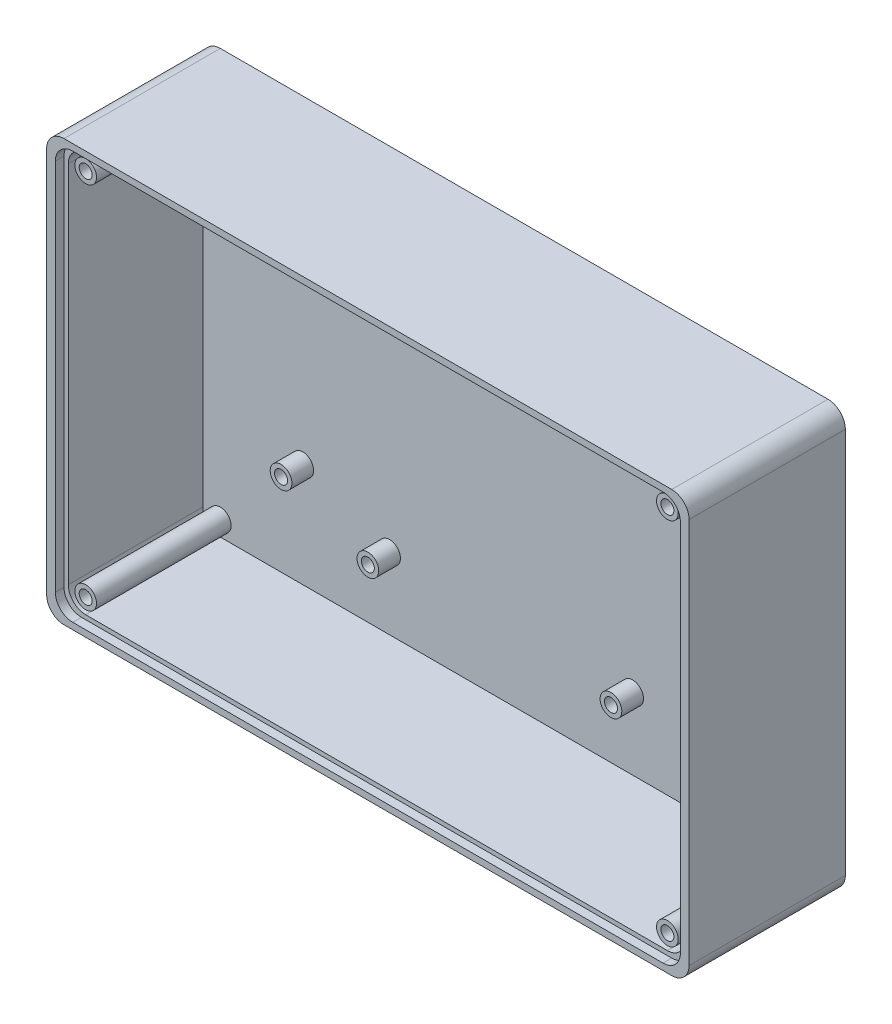
from build123d import *

# Parameters (mm, degrees)
RESSALTO_EXTRUS_O1_DEPTH = 18
CORTE_EXTRUS_O1_DEPTH    = 2
CORTE_EXTRUS_O2_DEPTH    = 31
ESBO_O4_R                = 2.5
ESBO_O4_R_2              = 1.5
RESSALTO_EXTRUS_O2_DEPTH = 5
ESBO_O5_R                = 2.5
ESBO_O5_R_2              = 1.5
RESSALTO_EXTRUS_O3_DEPTH = 31


with BuildPart() as part:
    # Esboço1 → Ressalto-extrusão1 (new, symmetric)
    with BuildSketch(Plane.XY):
        with BuildLine():
            Line((-70, -48.5), (70, -48.5))
            ThreePointArc((70, -48.5), (72.828427125, -47.328427125), (74, -44.5))
            Line((74, -44.5), (74, 44.5))
            ThreePointArc((74, 44.5), (72.828427125, 47.328427125), (70, 48.5))
            Line((70, 48.5), (-70, 48.5))
            ThreePointArc((-70, 48.5), (-72.828427125, 47.328427125), (-74, 44.5))
            Line((-74, 44.5), (-74, -44.5))
            ThreePointArc((-74, -44.5), (-72.828427125, -47.328427125), (-70, -48.5))
        make_face()
    extrude(amount=RESSALTO_EXTRUS_O1_DEPTH, both=True)

    # Esboço2 → Corte-extrusão1 (cut)
    with BuildSketch(Plane.XY.offset(18)):
        with BuildLine():
            Line((-68, -47), (68, -47))
            ThreePointArc((68, -47), (70.828427125, -45.828427125), (72, -43))
            Line((72, -43), (72, 43))
            ThreePointArc((72, 43), (70.828427125, 45.828427125), (68, 47))
            Line((68, 47), (-68, 47))
            ThreePointArc((-68, 47), (-70.828427125, 45.828427125), (-72, 43))
            Line((-72, 43), (-72, -43))
            ThreePointArc((-72, -43), (-70.828427125, -45.828427125), (-68, -47))
        make_face()
    extrude(amount=-CORTE_EXTRUS_O1_DEPTH, mode=Mode.SUBTRACT)

    # Esboço3 → Corte-extrusão2 (cut)
    with BuildSketch(Plane.XY.offset(16)):
        with BuildLine():
            Line((-67, -46), (67, -46))
            ThreePointArc((67, -46), (69.828427125, -44.828427125), (71, -42))
            Line((71, -42), (71, 42))
            ThreePointArc((71, 42), (69.828427125, 44.828427125), (67, 46))
            Line((67, 46), (-67, 46))
            ThreePointArc((-67, 46), (-69.828427125, 44.828427125), (-71, 42))
            Line((-71, 42), (-71, -42))
            ThreePointArc((-71, -42), (-69.828427125, -44.828427125), (-67, -46))
        make_face()
    extrude(amount=-CORTE_EXTRUS_O2_DEPTH, mode=Mode.SUBTRACT)

    # Esboço4 → Ressalto-extrusão2 (add)
    # profile 1 of 8: a face of its own
    with BuildSketch(Plane.XY.offset(-15)):
        with Locations(Location((-28, 29.5, 0), (0, 0, 180))):
            Circle(ESBO_O4_R)
        with Locations((-28, 29.5)):
            Circle(ESBO_O4_R_2, mode=Mode.SUBTRACT)
    # profile 2 of 8: a face of its own
    with BuildSketch(Plane.XY.offset(-15)):
        with Locations(Location((28, 29.5, 0), (0, 0, 180))):
            Circle(ESBO_O4_R)
        with Locations((28, 29.5)):
            Circle(ESBO_O4_R_2, mode=Mode.SUBTRACT)
    # profile 3 of 8: a face of its own
    with BuildSketch(Plane.XY.offset(-15)):
        with Locations(Location((28, -29.5, 0), (0, 0, 180))):
            Circle(ESBO_O4_R)
        with Locations((28, -29.5)):
            Circle(ESBO_O4_R_2, mode=Mode.SUBTRACT)
    # profile 4 of 8: a face of its own
    with BuildSketch(Plane.XY.offset(-15)):
        with Locations(Location((-28, -29.5, 0), (0, 0, 180))):
            Circle(ESBO_O4_R)
        with Locations((-28, -29.5)):
            Circle(ESBO_O4_R_2, mode=Mode.SUBTRACT)
    # profile 5 of 8: a face of its own
    with BuildSketch(Plane.XY.offset(-15)):
        with Locations(Location((-48, 22, 0), (0, 0, 180))):
            Circle(ESBO_O4_R)
        with Locations((-48, 22)):
            Circle(ESBO_O4_R_2, mode=Mode.SUBTRACT)
    # profile 6 of 8: a face of its own
    with BuildSketch(Plane.XY.offset(-15)):
        with Locations(Location((-48, -22, 0), (0, 0, 180))):
            Circle(ESBO_O4_R)
        with Locations((-48, -22)):
            Circle(ESBO_O4_R_2, mode=Mode.SUBTRACT)
    # profile 7 of 8: a face of its own
    with BuildSketch(Plane.XY.offset(-15)):
        with Locations(Location((48, -22, 0), (0, 0, 180))):
            Circle(ESBO_O4_R)
        with Locations((48, -22)):
            Circle(ESBO_O4_R_2, mode=Mode.SUBTRACT)
    # profile 8 of 8: a face of its own
    with BuildSketch(Plane.XY.offset(-15)):
        with Locations(Location((48, 22, 0), (0, 0, 180))):
            Circle(ESBO_O4_R)
        with Locations((48, 22)):
            Circle(ESBO_O4_R_2, mode=Mode.SUBTRACT)
    extrude(amount=RESSALTO_EXTRUS_O2_DEPTH)

    # Esboço5 → Ressalto-extrusão3 (add)
    # profile 1 of 4: a face of its own
    with BuildSketch(Plane.XY.offset(-15)):
        with Locations(Location((-67, -42.5, 0), (0, 0, 180))):
            Circle(ESBO_O5_R)
        with Locations(Location((-67, -42.5, 0), (0, 0, 180))):
            Circle(ESBO_O5_R_2, mode=Mode.SUBTRACT)
    # profile 2 of 4: a face of its own
    with BuildSketch(Plane.XY.offset(-15)):
        with Locations(Location((67, -42.5, 0), (0, 0, 180))):
            Circle(ESBO_O5_R)
        with Locations(Location((67, -42.5, 0), (0, 0, 180))):
            Circle(ESBO_O5_R_2, mode=Mode.SUBTRACT)
    # profile 3 of 4: a face of its own
    with BuildSketch(Plane.XY.offset(-15)):
        with Locations(Location((67, 42.5, 0), (0, 0, 180))):
            Circle(ESBO_O5_R)
        with Locations(Location((67, 42.5, 0), (0, 0, 180))):
            Circle(ESBO_O5_R_2, mode=Mode.SUBTRACT)
    # profile 4 of 4: a face of its own
    with BuildSketch(Plane.XY.offset(-15)):
        with Locations(Location((-67, 42.5, 0), (0, 0, 180))):
            Circle(ESBO_O5_R)
        with Locations(Location((-67, 42.5, 0), (0, 0, 180))):
            Circle(ESBO_O5_R_2, mode=Mode.SUBTRACT)
    extrude(amount=RESSALTO_EXTRUS_O3_DEPTH)


solid = part.part
